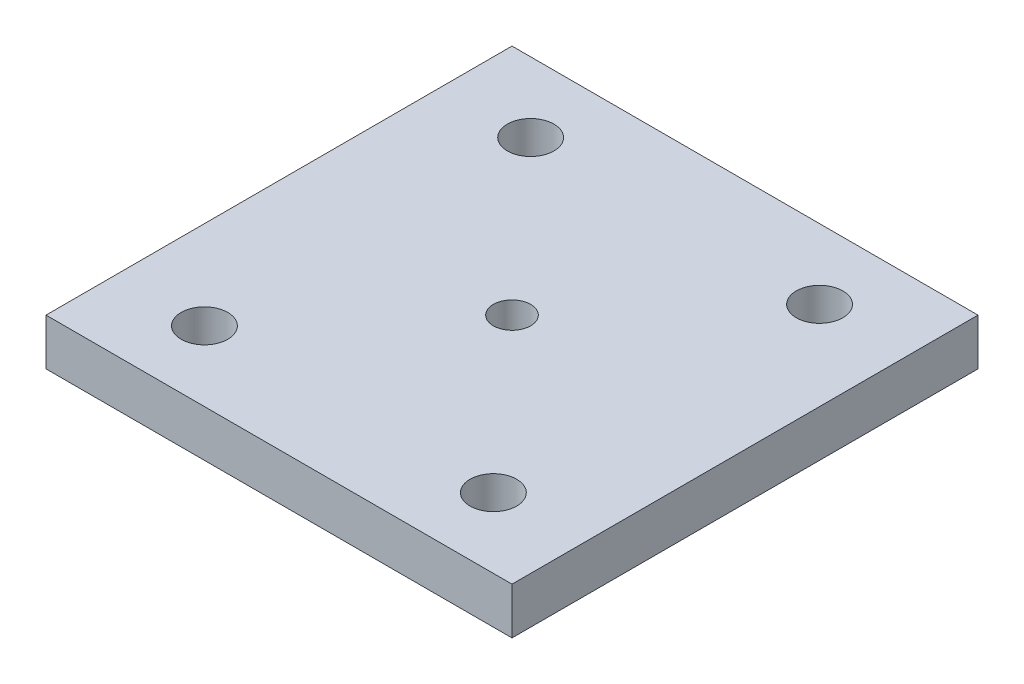
from build123d import *

# Parameters (mm, degrees)
SKETCH1_W           = 50
SKETCH1_H           = 50
BOSS_EXTRUDE1_DEPTH = 5
SKETCH2_R           = 2
CUT_EXTRUDE1_DEPTH  = 5
SKETCH3_R           = 2.5
CUT_EXTRUDE2_DEPTH  = 10


with BuildPart() as part:
    # Sketch1 → Boss-Extrude1 (new body)
    with BuildSketch(Plane(origin=(0, 0, 0), x_dir=(1, 0, 0), z_dir=(0, 1, 0))):
        with Locations((25, 25)):
            Rectangle(SKETCH1_W, SKETCH1_H)
    extrude(amount=BOSS_EXTRUDE1_DEPTH)

    # Sketch2 → Cut-Extrude1 (cut)
    with BuildSketch(Plane(origin=(0, 5, 0), x_dir=(1, 0, 0), z_dir=(0, 1, 0))):
        with Locations(Location((25, 25, 0), (0, 0, 270))):
            Circle(SKETCH2_R)
    extrude(amount=-CUT_EXTRUDE1_DEPTH, mode=Mode.SUBTRACT)

    # Sketch3 → Cut-Extrude2 (cut)
    with BuildSketch(Plane.XZ):
        with Locations(Location((40.5, -42.5, 0), (0, 0, 270))):
            Circle(SKETCH3_R)
        with Locations(Location((9.5, -42.5, 0), (0, 0, 270))):
            Circle(SKETCH3_R)
        with Locations(Location((9.5, -7.5, 0), (0, 0, 270))):
            Circle(SKETCH3_R)
        with Locations(Location((40.5, -7.5, 0), (0, 0, 270))):
            Circle(SKETCH3_R)
    extrude(amount=-CUT_EXTRUDE2_DEPTH, mode=Mode.SUBTRACT)


solid = part.part
